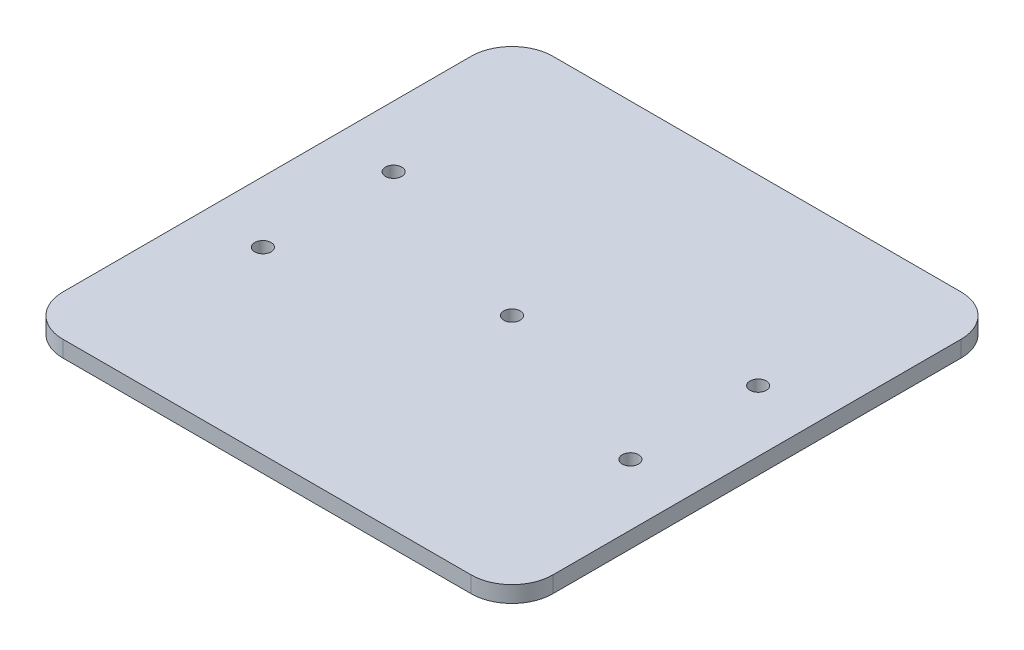
from build123d import *

# Parameters (mm, degrees)
BOSS_EXTRUDE1_DEPTH = 2
SKETCH2_R           = 1
CUT_EXTRUDE1_DEPTH  = 3


with BuildPart() as part:
    # Sketch1 → Boss-Extrude1 (new body)
    with BuildSketch(Plane(origin=(0, 0, 0), x_dir=(1, 0, 0), z_dir=(0, 1, 0))):
        with BuildLine():
            Line((-25.218978102, 28.02919708), (24.781021898, 28.02919708))
            ThreePointArc((24.781021898, 28.02919708), (28.316555804, 26.564730986), (29.781021898, 23.02919708))
            Line((29.781021898, 23.02919708), (29.781021898, -26.97080292))
            ThreePointArc((29.781021898, -26.97080292), (28.316555804, -30.506336826), (24.781021898, -31.97080292))
            Line((24.781021898, -31.97080292), (-25.218978102, -31.97080292))
            ThreePointArc((-25.218978102, -31.97080292), (-28.754512008, -30.506336826), (-30.218978102, -26.97080292))
            Line((-30.218978102, -26.97080292), (-30.218978102, 23.02919708))
            ThreePointArc((-30.218978102, 23.02919708), (-28.754512008, 26.564730986), (-25.218978102, 28.02919708))
        make_face()
    extrude(amount=BOSS_EXTRUDE1_DEPTH)

    # Sketch2 → Cut-Extrude1 (cut)
    with BuildSketch(Plane(origin=(0, 2, 0), x_dir=(1, 0, 0), z_dir=(0, 1, 0))):
        with Locations(Location((-22.718978102, 6.02919708, 0), (0, 0, 270))):
            Circle(SKETCH2_R)
        with Locations(Location((-22.718978102, -9.97080292, 0), (0, 0, 270))):
            Circle(SKETCH2_R)
        with Locations(Location((22.281021898, 5.669895239, 0), (0, 0, 270))):
            Circle(SKETCH2_R)
        with Locations(Location((22.281021898, -9.97080292, 0), (0, 0, 270))):
            Circle(SKETCH2_R)
        with Locations(Location((-0.218978102, -1.97080292, 0), (0, 0, 270))):
            Circle(SKETCH2_R)
    extrude(amount=-CUT_EXTRUDE1_DEPTH, mode=Mode.SUBTRACT)


solid = part.part
